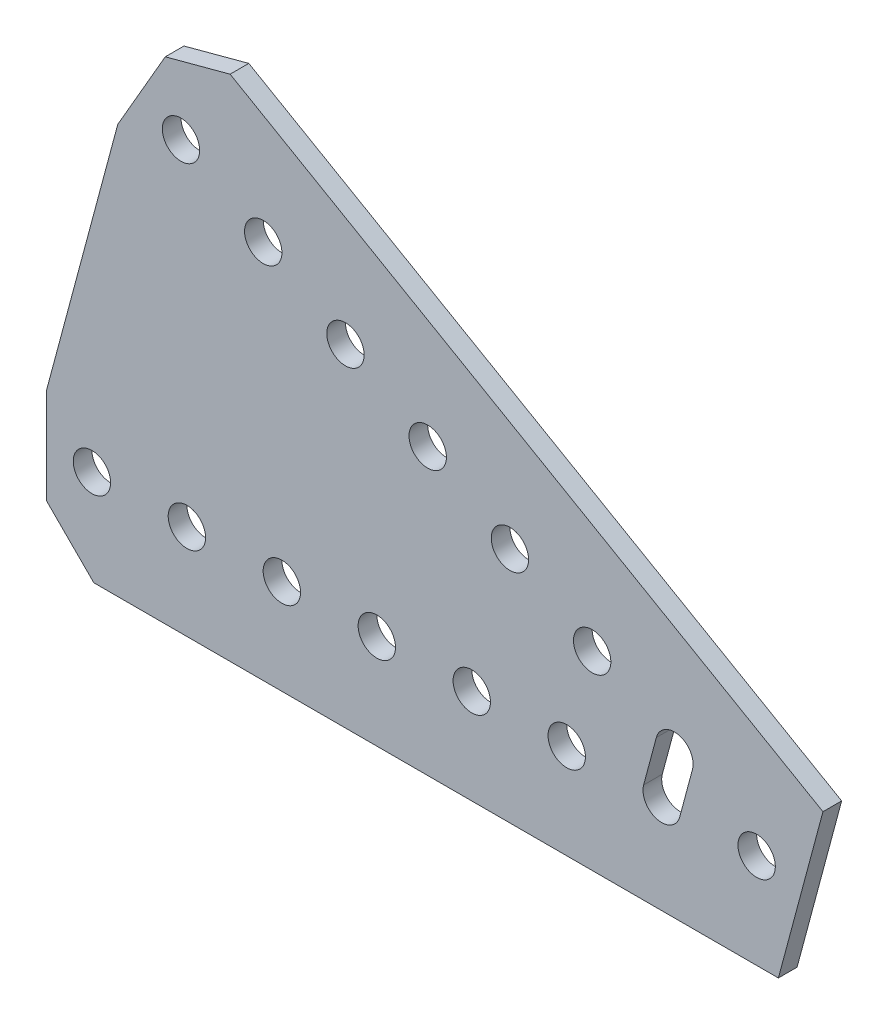
from build123d import *

# Parameters (mm, degrees)
SKETCH1_R           = 2.5
BOSS_EXTRUDE1_DEPTH = 2.5


with BuildPart() as part:
    # Sketch1 → Boss-Extrude1 (new body)
    with BuildSketch(Plane(origin=(0, 0, -1.25), x_dir=(-1, 0, 0), z_dir=(0, 0, -1))):
        Polygon((-2.908088852, -12.7), (88.646, -12.7), (94.996, -6.35), (94.996, 6.35), (85.443949258, 41.998738686), (79.093949258, 52.997261314), (70.419687944, 55.321522628), (-8.868478822, 9.544478202), align=None)
        with Locations(Location((25.4, 0, 0), (0, 0, 180))):
            Circle(SKETCH1_R, mode=Mode.SUBTRACT)
        with Locations(Location((38.1, 0, 0), (0, 0, 180))):
            Circle(SKETCH1_R, mode=Mode.SUBTRACT)
        with Locations(Location((50.8, 0, 0), (0, 0, 180))):
            Circle(SKETCH1_R, mode=Mode.SUBTRACT)
        with Locations(Location((63.5, 0, 0), (0, 0, 180))):
            Circle(SKETCH1_R, mode=Mode.SUBTRACT)
        with Locations(Location((0, 0, 0), (0, 0, 180))):
            Circle(SKETCH1_R, mode=Mode.SUBTRACT)
        with Locations(Location((88.9, 0, 0), (0, 0, 180))):
            Circle(SKETCH1_R, mode=Mode.SUBTRACT)
        with Locations(Location((76.2, 0, 0), (0, 0, 180))):
            Circle(SKETCH1_R, mode=Mode.SUBTRACT)
        with Locations(Location((76.989658396, 44.45, 0), (0, 0, 180))):
            Circle(SKETCH1_R, mode=Mode.SUBTRACT)
        with Locations(Location((65.991135768, 38.1, 0), (0, 0, 180))):
            Circle(SKETCH1_R, mode=Mode.SUBTRACT)
        with Locations(Location((54.99261314, 31.75, 0), (0, 0, 180))):
            Circle(SKETCH1_R, mode=Mode.SUBTRACT)
        with Locations(Location((43.994090512, 25.4, 0), (0, 0, 180))):
            Circle(SKETCH1_R, mode=Mode.SUBTRACT)
        with Locations(Location((32.995567884, 19.05, 0), (0, 0, 180))):
            Circle(SKETCH1_R, mode=Mode.SUBTRACT)
        with Locations(Location((21.997045256, 12.7, 0), (0, 0, 180))):
            Circle(SKETCH1_R, mode=Mode.SUBTRACT)
        with BuildLine():
            Line((10.285185434, -0.647047613), (8.583708062, 5.702952387))
            ThreePointArc((8.583708062, 5.702952387), (10.351475015, 8.764814566), (13.413337194, 6.997047613))
            Line((13.413337194, 6.997047613), (15.114814566, 0.647047613))
            ThreePointArc((15.114814566, 0.647047613), (13.347047613, -2.414814566), (10.285185434, -0.647047613))
        make_face(mode=Mode.SUBTRACT)
    extrude(amount=-BOSS_EXTRUDE1_DEPTH)


solid = part.part
